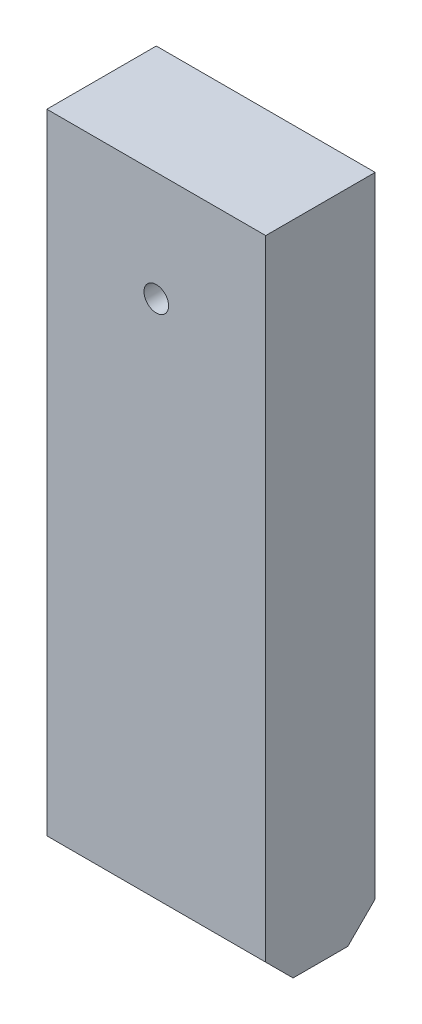
from build123d import *

# Parameters (mm, degrees)
ESQUISSE1_W                  = 40
ESQUISSE1_H                  = 120
BOSS_EXTRU_1_DEPTH           = 20
CHANFREIN2_SIZE              = 5
ENL_V_MAT_EXTRU_1_DEPTH      = 129.062484749
ENL_V_MAT_EXTRU_1_DEPTH_BACK = 129.062484749
ESQUISSE3_R                  = 2.25


with BuildPart() as part:
    # Esquisse1 → Boss.-Extru.1 (new body)
    with BuildSketch(Plane.XY):
        with Locations((20, 60)):
            Rectangle(ESQUISSE1_W, ESQUISSE1_H)
    extrude(amount=BOSS_EXTRU_1_DEPTH)

    # Chanfrein2
    chanfrein2_edges = [part.edges().sort_by_distance(p)[0] for p in [
        (20, 0, 0),
        (20, 0, 20),
    ]]
    chamfer(chanfrein2_edges, length=CHANFREIN2_SIZE)

    # Esquisse3 → Enlèv. mat.-Extru.1 (cut, two sides: drawn at the far end of the back side and taken through both)
    with BuildSketch(Plane.XY.offset(20).offset(-ENL_V_MAT_EXTRU_1_DEPTH_BACK)):
        with Locations((20, 100)):
            Circle(ESQUISSE3_R)
    extrude(amount=ENL_V_MAT_EXTRU_1_DEPTH + ENL_V_MAT_EXTRU_1_DEPTH_BACK, mode=Mode.SUBTRACT)


solid = part.part
